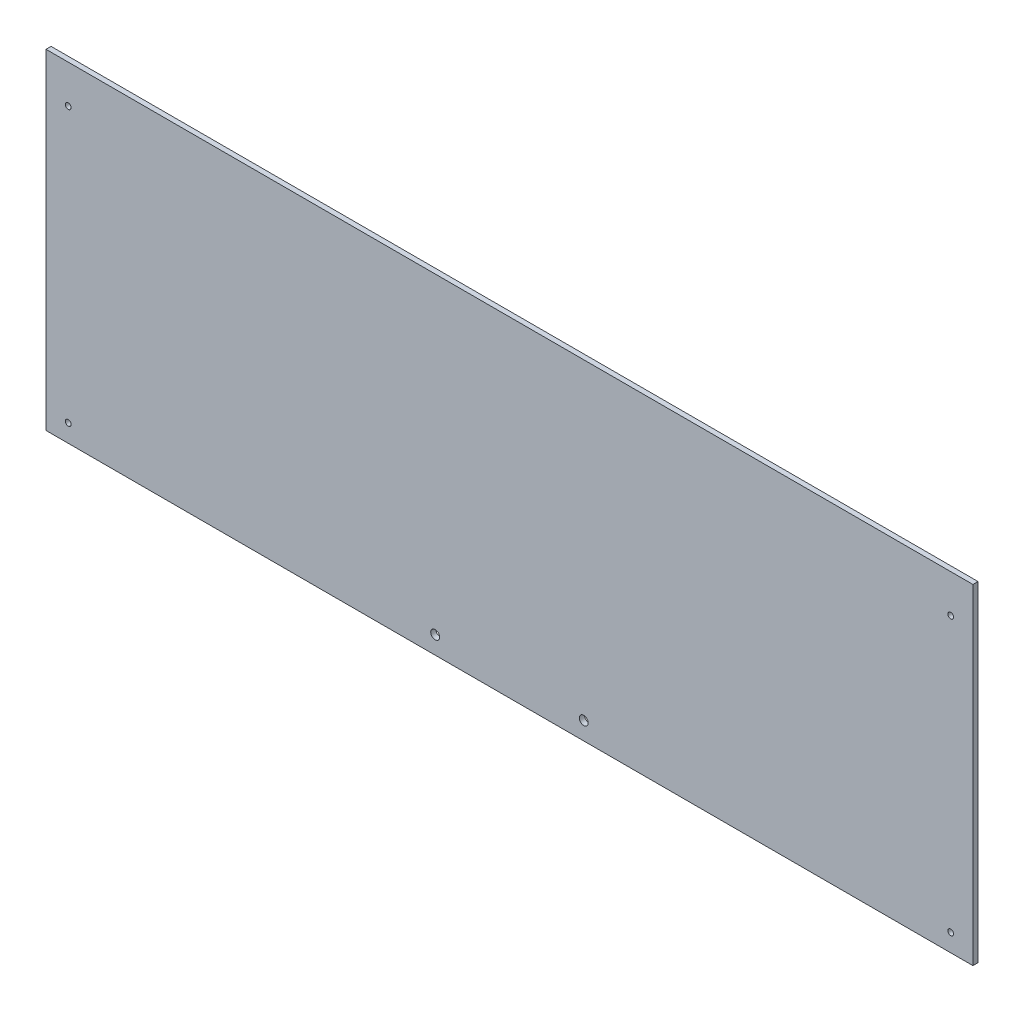
from build123d import *

# Parameters (mm, degrees)
SKETCH1_W           = 730
SKETCH1_H           = 260
BOSS_EXTRUDE1_DEPTH = 2
SKETCH2_R           = 2.25
SKETCH2_R_2         = 3.5
CUT_EXTRUDE1_DEPTH  = 449.152875702


with BuildPart() as part:
    # Sketch1 → Boss-Extrude1 (new, symmetric)
    with BuildSketch(Plane.XY):
        with Locations((0, -130)):
            Rectangle(SKETCH1_W, SKETCH1_H)
    extrude(amount=BOSS_EXTRUDE1_DEPTH, both=True)

    # Sketch2 → Cut-Extrude1 (cut, through all)
    with BuildSketch(Plane.XY.offset(2)):
        with Locations((-347.5, -30)):
            Circle(SKETCH2_R)
        with Locations((-347.5, -246)):
            Circle(SKETCH2_R)
        with Locations((-58.5, -246)):
            Circle(SKETCH2_R_2)
        with Locations(Location((58.5, -246, 0), (0, 0, 180))):
            Circle(SKETCH2_R_2)
        with Locations(Location((347.5, -246, 0), (0, 0, 180))):
            Circle(SKETCH2_R)
        with Locations(Location((347.5, -30, 0), (0, 0, 180))):
            Circle(SKETCH2_R)
    extrude(amount=-CUT_EXTRUDE1_DEPTH, mode=Mode.SUBTRACT)


solid = part.part
